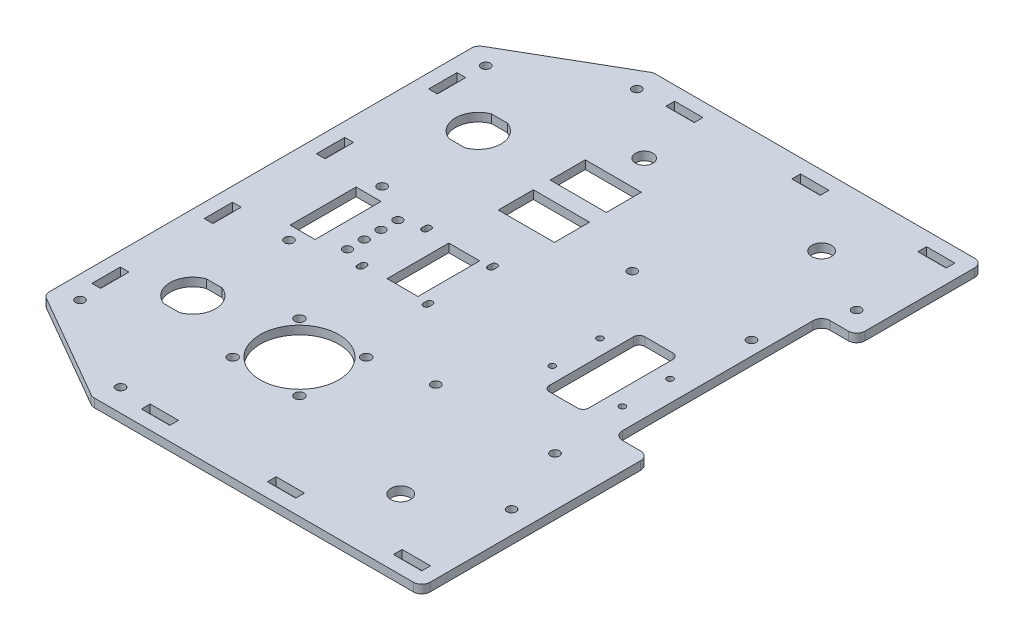
from build123d import *

# Parameters (mm, degrees)
SKETCH1_R           = 1.6
SKETCH1_W           = 11
SKETCH1_H           = 22
BOSS_EXTRUDE1_DEPTH = 3
SKETCH5_R           = 1.6
CUT_EXTRUDE2_DEPTH  = 161.106214887
SKETCH8_R           = 3.1
SKETCH8_W           = 20
SKETCH8_H           = 12.5
CUT_EXTRUDE5_DEPTH  = 161.106214887
CUT_EXTRUDE8_DEPTH  = 161.106214887
SKETCH12_R          = 1.55
CUT_EXTRUDE9_DEPTH  = 161.106214887
SKETCH15_W          = 12.5
SKETCH15_H          = 74
CUT_EXTRUDE12_DEPTH = 161.106214887
CUT_EXTRUDE10_REACH = 162.106
SKETCH13_R          = 1.6
SKETCH14_W          = 3.1
SKETCH14_H          = 10.1
CUT_EXTRUDE11_DEPTH = 161.106214887
FILLET3_R           = 3
SKETCH16_W          = 10.1
SKETCH16_H          = 3.1
CUT_EXTRUDE13_DEPTH = 161.106214887
SKETCH17_W          = 8.9
SKETCH17_H          = 23.5
CUT_EXTRUDE14_DEPTH = 161.106214887
SKETCH18_R          = 3.5
CUT_EXTRUDE15_DEPTH = 161.106214887
SKETCH19_R          = 1.1
CUT_EXTRUDE16_DEPTH = 161.106214887


with BuildPart() as part:
    # Sketch1 → Boss-Extrude1 (new body)
    with BuildSketch(Plane(origin=(0, 0, 0), x_dir=(1, 0, 0), z_dir=(0, 1, 0))):
        Polygon((32.5, -100), (32.5, 100), (-85, 100), (-125, 76.905989232), (-125, -76.905989232), (-85, -100), align=None)
        with Locations(Location((-98.22599998, -16.6, 0), (0, 0, 270))):
            Circle(SKETCH1_R, mode=Mode.SUBTRACT)
        with Locations(Location((-98.22599998, 16.6, 0), (0, 0, 270))):
            Circle(SKETCH1_R, mode=Mode.SUBTRACT)
        with BuildLine():
            add(Edge.make_bspline(
                [(-50.0260005, -38.958999686), (-50.026000351, -42.358999686), (-46.626000351, -42.358999538), (-46.6260005, -38.958999538), (-46.626000649, -35.558999538), (-50.026000649, -35.558999686), (-50.0260005, -38.958999686)],
                knots=[0, 0, 0, 0, 0.5, 0.5, 0.5, 1, 1, 1, 1], degree=3, weights=[1, 0.333333333, 0.333333333, 1, 0.333333333, 0.333333333, 1]))
        make_face(mode=Mode.SUBTRACT)
        with BuildLine():
            add(Edge.make_bspline(
                [(-50.02599946, -62.758999686), (-50.025999311, -66.158999686), (-46.625999311, -66.158999538), (-46.62599946, -62.758999538), (-46.625999608, -59.358999538), (-50.025999608, -59.358999686), (-50.02599946, -62.758999686)],
                knots=[0, 0, 0, 0, 0.5, 0.5, 0.5, 1, 1, 1, 1], degree=3, weights=[1, 0.333333333, 0.333333333, 1, 0.333333333, 0.333333333, 1]))
        make_face(mode=Mode.SUBTRACT)
        with BuildLine():
            add(Edge.make_bspline(
                [(-73.82599946, -62.759000727), (-73.825999311, -66.159000727), (-70.425999311, -66.159000578), (-70.42599946, -62.759000578), (-70.425999608, -59.359000578), (-73.825999608, -59.359000727), (-73.82599946, -62.759000727)],
                knots=[0, 0, 0, 0, 0.5, 0.5, 0.5, 1, 1, 1, 1], degree=3, weights=[1, 0.333333333, 0.333333333, 1, 0.333333333, 0.333333333, 1]))
        make_face(mode=Mode.SUBTRACT)
        with BuildLine():
            add(Edge.make_bspline(
                [(-73.8260005, -38.959000727), (-73.826000351, -42.359000727), (-70.426000351, -42.359000578), (-70.4260005, -38.959000578), (-70.426000649, -35.559000578), (-73.826000649, -35.559000727), (-73.8260005, -38.959000727)],
                knots=[0, 0, 0, 0, 0.5, 0.5, 0.5, 1, 1, 1, 1], degree=3, weights=[1, 0.333333333, 0.333333333, 1, 0.333333333, 0.333333333, 1]))
        make_face(mode=Mode.SUBTRACT)
        with Locations((-63.350999836, 0)):
            Rectangle(SKETCH1_W, SKETCH1_H, mode=Mode.SUBTRACT)
        with BuildLine():
            Line((-76.200999836, -12.05), (-76.200999836, -10.95))
            ThreePointArc((-76.200999836, -10.95), (-77.300999836, -9.85), (-78.400999836, -10.95))
            Line((-78.400999836, -10.95), (-78.400999836, -12.05))
            ThreePointArc((-78.400999836, -12.05), (-77.300999836, -13.15), (-76.200999836, -12.05))
        make_face(mode=Mode.SUBTRACT)
        with BuildLine():
            Line((-54.900999836, -10.95), (-54.900999836, -12.05))
            ThreePointArc((-54.900999836, -12.05), (-53.800999836, -13.15), (-52.700999836, -12.05))
            Line((-52.700999836, -12.05), (-52.700999836, -10.95))
            ThreePointArc((-52.700999836, -10.95), (-53.800999836, -9.85), (-54.900999836, -10.95))
        make_face(mode=Mode.SUBTRACT)
        with BuildLine():
            Line((-52.700999836, 10.95), (-52.700999836, 12.05))
            ThreePointArc((-52.700999836, 12.05), (-53.800999836, 13.15), (-54.900999836, 12.05))
            Line((-54.900999836, 12.05), (-54.900999836, 10.95))
            ThreePointArc((-54.900999836, 10.95), (-53.800999836, 9.85), (-52.700999836, 10.95))
        make_face(mode=Mode.SUBTRACT)
        with BuildLine():
            Line((-76.200999836, 10.95), (-76.200999836, 12.05))
            ThreePointArc((-76.200999836, 12.05), (-77.300999836, 13.15), (-78.400999836, 12.05))
            Line((-78.400999836, 12.05), (-78.400999836, 10.95))
            ThreePointArc((-78.400999836, 10.95), (-77.300999836, 9.85), (-76.200999836, 10.95))
        make_face(mode=Mode.SUBTRACT)
        with BuildLine():
            add(Edge.make_bspline(
                [(-72.862872761, -56.884732146), (-73.764033973, -54.994860582), (-74.225999888, -52.952730922), (-74.22599998, -50.859000744)],
                knots=[0, 0, 0, 0, 1, 1, 1, 1], degree=3, weights=[1, 0.983569835, 0.983569835, 1]))
            add(Edge.make_bspline(
                [(-74.22599998, -50.859000744), (-74.226000316, -43.160577736), (-69.000623793, -37.507157797), (-61.32600059, -36.902281401)],
                knots=[0, 0, 0, 0, 1, 1, 1, 1], degree=3, weights=[1, 0.822907168, 0.822907168, 1]))
            add(Edge.make_bspline(
                [(-59.12600059, -36.902281305), (-59.858576662, -36.84454329), (-60.593424523, -36.844543323), (-61.32600059, -36.902281401)],
                knots=[0, 0, 0, 0, 1, 1, 1, 1], degree=3, weights=[1, 0.997938991, 0.997938991, 1]))
            add(Edge.make_bspline(
                [(-59.12600059, -36.902281305), (-48.341925174, -37.752228634), (-42.933165825, -47.120473687), (-47.589126672, -56.884731074)],
                knots=[0, 0, 0, 0, 1, 1, 1, 1], degree=3, weights=[1, 0.710999398, 0.710999398, 1]))
            add(Edge.make_bspline(
                [(-48.689126588, -58.789986978), (-48.272835965, -58.184426529), (-47.905412062, -57.548029598), (-47.589126672, -56.884731074)],
                knots=[0, 0, 0, 0, 1, 1, 1, 1], degree=3, weights=[1, 0.997938991, 0.997938991, 1]))
            add(Edge.make_bspline(
                [(-48.689126588, -58.789986978), (-54.817240303, -67.704296563), (-65.634758183, -67.704297036), (-71.762872678, -58.789988019)],
                knots=[0, 0, 0, 0, 1, 1, 1, 1], degree=3, weights=[1, 0.710999398, 0.710999398, 1]))
            add(Edge.make_bspline(
                [(-72.862872761, -56.884732146), (-72.546587312, -57.548030675), (-72.179163354, -58.184427574), (-71.762872678, -58.789988019)],
                knots=[0, 0, 0, 0, 0.999999975, 0.999999975, 0.999999975, 0.999999975], degree=3, weights=[1, 0.997938991, 0.997938991, 1]))
        make_face(mode=Mode.SUBTRACT)
    extrude(amount=BOSS_EXTRUDE1_DEPTH)

    # Sketch5 → Cut-Extrude2 (cut, through all)
    with BuildSketch(Plane(origin=(0, 3, 0), x_dir=(1, 0, 0), z_dir=(0, 1, 0))):
        with Locations(Location((-27.5, 35, 0), (0, 0, 270))):
            Circle(SKETCH5_R)
        with Locations(Location((15, 35, 0), (0, 0, 270))):
            Circle(SKETCH5_R)
        with Locations(Location((-27.5, -35, 0), (0, 0, 270))):
            Circle(SKETCH5_R)
        with Locations(Location((15, -35, 0), (0, 0, 270))):
            Circle(SKETCH5_R)
    extrude(amount=-CUT_EXTRUDE2_DEPTH, mode=Mode.SUBTRACT)

    # Sketch8 → Cut-Extrude5 (cut, through all)
    with BuildSketch(Plane(origin=(0, 3, 0), x_dir=(1, 0, 0), z_dir=(0, 1, 0))):
        with Locations(Location((-60.22599998, 72, 0), (0, 0, 270))):
            Circle(SKETCH8_R)
        with Locations((-60.22599998, 36.25)):
            Rectangle(SKETCH8_W, SKETCH8_H)
        with Locations((-60.22599998, 54.75)):
            Rectangle(SKETCH8_W, SKETCH8_H)
    extrude(amount=-CUT_EXTRUDE5_DEPTH, mode=Mode.SUBTRACT)

    # Sketch11 → Cut-Extrude8 (cut, through all)
    with BuildSketch(Plane(origin=(0, 3, 0), x_dir=(1, 0, 0), z_dir=(0, 1, 0))):
        with BuildLine():
            Line((-101.027785125, -43.259000132), (-95.424214835, -43.259000132))
            ThreePointArc((-95.424214835, -43.259000132), (-90.12599998, -50.859000132), (-95.424214835, -58.459000132))
            Line((-95.424214835, -58.459000132), (-101.027785125, -58.459000132))
            ThreePointArc((-101.027785125, -58.459000132), (-106.32599998, -50.859000132), (-101.027785125, -43.259000132))
        make_face()
        with BuildLine():
            Line((-101.027785125, 58.459000132), (-95.424214835, 58.459000132))
            ThreePointArc((-95.424214835, 58.459000132), (-90.12599998, 50.859000132), (-95.424214835, 43.259000132))
            Line((-95.424214835, 43.259000132), (-101.027785125, 43.259000132))
            ThreePointArc((-101.027785125, 43.259000132), (-106.32599998, 50.859000132), (-101.027785125, 58.459000132))
        make_face()
    extrude(amount=-CUT_EXTRUDE8_DEPTH, mode=Mode.SUBTRACT)

    # Sketch12 → Cut-Extrude9 (cut, through all)
    with BuildSketch(Plane(origin=(0, 3, 0), x_dir=(1, 0, 0), z_dir=(0, 1, 0))):
        with Locations(Location((-85, 9, 0), (0, 0, 270))):
            Circle(SKETCH12_R)
        with Locations(Location((-85, 3, 0), (0, 0, 270))):
            Circle(SKETCH12_R)
        with Locations(Location((-85, -3, 0), (0, 0, 270))):
            Circle(SKETCH12_R)
        with Locations(Location((-85, -9, 0), (0, 0, 270))):
            Circle(SKETCH12_R)
    extrude(amount=-CUT_EXTRUDE9_DEPTH, mode=Mode.SUBTRACT)

    # Sketch15 → Cut-Extrude12 (cut, through all)
    with BuildSketch(Plane(origin=(0, 3, 0), x_dir=(1, 0, 0), z_dir=(0, 1, 0))):
        with Locations((26.25, 18)):
            Rectangle(SKETCH15_W, SKETCH15_H)
    extrude(amount=-CUT_EXTRUDE12_DEPTH, mode=Mode.SUBTRACT)

    # Sketch13 → Cut-Extrude10 (cut, up to next)
    with BuildSketch(Plane(origin=(0, 3, 0), x_dir=(1, 0, 0), z_dir=(0, 1, 0)), mode=Mode.PRIVATE) as cut_extrude10_sk1:
        with Locations(Location((24.5, 63, 0), (0, 0, 270))):
            Circle(SKETCH13_R)
    cut_extrude10_tool1 = extrude(cut_extrude10_sk1.sketch, amount=-CUT_EXTRUDE10_REACH, mode=Mode.PRIVATE) & part.part
    # Sketch13 → Cut-Extrude10 (cut, up to next)
    with BuildSketch(Plane(origin=(0, 3, 0), x_dir=(1, 0, 0), z_dir=(0, 1, 0)), mode=Mode.PRIVATE) as cut_extrude10_sk2:
        with Locations(Location((24.5, -60, 0), (0, 0, 270))):
            Circle(SKETCH13_R)
    cut_extrude10_tool2 = extrude(cut_extrude10_sk2.sketch, amount=-CUT_EXTRUDE10_REACH, mode=Mode.PRIVATE) & part.part
    # Sketch13 → Cut-Extrude10 (cut, up to next)
    with BuildSketch(Plane(origin=(0, 3, 0), x_dir=(1, 0, 0), z_dir=(0, 1, 0)), mode=Mode.PRIVATE) as cut_extrude10_sk3:
        with Locations(Location((-82.856406461, -92, 0), (0, 0, 270))):
            Circle(SKETCH13_R)
    cut_extrude10_tool3 = extrude(cut_extrude10_sk3.sketch, amount=-CUT_EXTRUDE10_REACH, mode=Mode.PRIVATE) & part.part
    # Sketch13 → Cut-Extrude10 (cut, up to next)
    with BuildSketch(Plane(origin=(0, 3, 0), x_dir=(1, 0, 0), z_dir=(0, 1, 0)), mode=Mode.PRIVATE) as cut_extrude10_sk4:
        with Locations(Location((-117, -72.287187079, 0), (0, 0, 270))):
            Circle(SKETCH13_R)
    cut_extrude10_tool4 = extrude(cut_extrude10_sk4.sketch, amount=-CUT_EXTRUDE10_REACH, mode=Mode.PRIVATE) & part.part
    # Sketch13 → Cut-Extrude10 (cut, up to next)
    with BuildSketch(Plane(origin=(0, 3, 0), x_dir=(1, 0, 0), z_dir=(0, 1, 0)), mode=Mode.PRIVATE) as cut_extrude10_sk5:
        with Locations(Location((-117, 72.287187079, 0), (0, 0, 270))):
            Circle(SKETCH13_R)
    cut_extrude10_tool5 = extrude(cut_extrude10_sk5.sketch, amount=-CUT_EXTRUDE10_REACH, mode=Mode.PRIVATE) & part.part
    # Sketch13 → Cut-Extrude10 (cut, up to next)
    with BuildSketch(Plane(origin=(0, 3, 0), x_dir=(1, 0, 0), z_dir=(0, 1, 0)), mode=Mode.PRIVATE) as cut_extrude10_sk6:
        with Locations(Location((-82.856406461, 92, 0), (0, 0, 270))):
            Circle(SKETCH13_R)
    cut_extrude10_tool6 = extrude(cut_extrude10_sk6.sketch, amount=-CUT_EXTRUDE10_REACH, mode=Mode.PRIVATE) & part.part
    add(cut_extrude10_tool1.solids().sort_by_distance((24.5, 3, -63))[0], mode=Mode.SUBTRACT)
    add(cut_extrude10_tool2.solids().sort_by_distance((24.5, 3, 60))[0], mode=Mode.SUBTRACT)
    add(cut_extrude10_tool3.solids().sort_by_distance((-82.856406, 3, 92))[0], mode=Mode.SUBTRACT)
    add(cut_extrude10_tool4.solids().sort_by_distance((-117, 3, 72.287187))[0], mode=Mode.SUBTRACT)
    add(cut_extrude10_tool5.solids().sort_by_distance((-117, 3, -72.287187))[0], mode=Mode.SUBTRACT)
    add(cut_extrude10_tool6.solids().sort_by_distance((-82.856406, 3, -92))[0], mode=Mode.SUBTRACT)

    # Sketch14 → Cut-Extrude11 (cut, through all)
    with BuildSketch(Plane(origin=(0, 3, 0), x_dir=(1, 0, 0), z_dir=(0, 1, 0))):
        with Locations((-118.45, 60)):
            Rectangle(SKETCH14_W, SKETCH14_H)
        with Locations((-118.45, 20)):
            Rectangle(SKETCH14_W, SKETCH14_H)
        with Locations((-118.45, -20)):
            Rectangle(SKETCH14_W, SKETCH14_H)
        with Locations((-118.45, -60)):
            Rectangle(SKETCH14_W, SKETCH14_H)
    extrude(amount=-CUT_EXTRUDE11_DEPTH, mode=Mode.SUBTRACT)

    # Fillet3
    fillet3_edges = [part.edges().sort_by_distance(p)[0] for p in [
        (32.5, 1.5, -100),
        (32.5, 1.5, 100),
        (-85, 1.5, 100),
        (-125, 1.5, 76.905989232),
        (-125, 1.5, -76.905989232),
        (-85, 1.5, -100),
        (32.5, 1.5, -55),
        (32.5, 1.5, 19),
        (20, 1.5, 19),
        (20, 1.5, -55),
    ]]
    fillet(fillet3_edges, radius=FILLET3_R)

    # Sketch16 → Cut-Extrude13 (cut, through all)
    with BuildSketch(Plane(origin=(0, 3, 0), x_dir=(1, 0, 0), z_dir=(0, 1, 0))):
        with Locations((22.45, -93.45)):
            Rectangle(SKETCH16_W, SKETCH16_H)
        with Locations((-22.45, -93.45)):
            Rectangle(SKETCH16_W, SKETCH16_H)
        with Locations((-67.35, -93.45)):
            Rectangle(SKETCH16_W, SKETCH16_H)
        with Locations((22.45, 93.45)):
            Rectangle(SKETCH16_W, SKETCH16_H)
        with Locations((-22.45, 93.45)):
            Rectangle(SKETCH16_W, SKETCH16_H)
        with Locations((-67.35, 93.45)):
            Rectangle(SKETCH16_W, SKETCH16_H)
    extrude(amount=-CUT_EXTRUDE13_DEPTH, mode=Mode.SUBTRACT)

    # Sketch17 → Cut-Extrude14 (cut, through all)
    with BuildSketch(Plane(origin=(0, 3, 0), x_dir=(1, 0, 0), z_dir=(0, 1, 0))):
        with Locations((-98.22599998, 0)):
            Rectangle(SKETCH17_W, SKETCH17_H)
    extrude(amount=-CUT_EXTRUDE14_DEPTH, mode=Mode.SUBTRACT)

    # Sketch18 → Cut-Extrude15 (cut, through all)
    with BuildSketch(Plane(origin=(0, 3, 0), x_dir=(1, 0, 0), z_dir=(0, 1, 0))):
        with Locations(Location((0, 75, 0), (0, 0, 270))):
            Circle(SKETCH18_R)
        with Locations(Location((0, -75, 0), (0, 0, 90))):
            Circle(SKETCH18_R)
    extrude(amount=-CUT_EXTRUDE15_DEPTH, mode=Mode.SUBTRACT)

    # Sketch19 → Cut-Extrude16 (cut, through all)
    with BuildSketch(Plane(origin=(0, 3, 0), x_dir=(1, 0, 0), z_dir=(0, 1, 0))):
        with Locations(Location((-12.5, 8.5, 0), (0, 0, 270))):
            Circle(SKETCH19_R)
        with Locations(Location((-12.5, -8.5, 0), (0, 0, 90))):
            Circle(SKETCH19_R)
        with Locations(Location((12.5, -8.5, 0), (0, 0, 270))):
            Circle(SKETCH19_R)
        with Locations(Location((12.5, 8.5, 0), (0, 0, 90))):
            Circle(SKETCH19_R)
        with BuildLine():
            Line((-5, 17), (5, 17))
            ThreePointArc((5, 17), (6.414213562, 16.414213562), (7, 15))
            Line((7, 15), (7, -15))
            ThreePointArc((7, -15), (6.414213562, -16.414213562), (5, -17))
            Line((5, -17), (-5, -17))
            ThreePointArc((-5, -17), (-6.414213562, -16.414213562), (-7, -15))
            Line((-7, -15), (-7, 15))
            ThreePointArc((-7, 15), (-6.414213562, 16.414213562), (-5, 17))
        make_face()
    extrude(amount=-CUT_EXTRUDE16_DEPTH, mode=Mode.SUBTRACT)


solid = part.part
